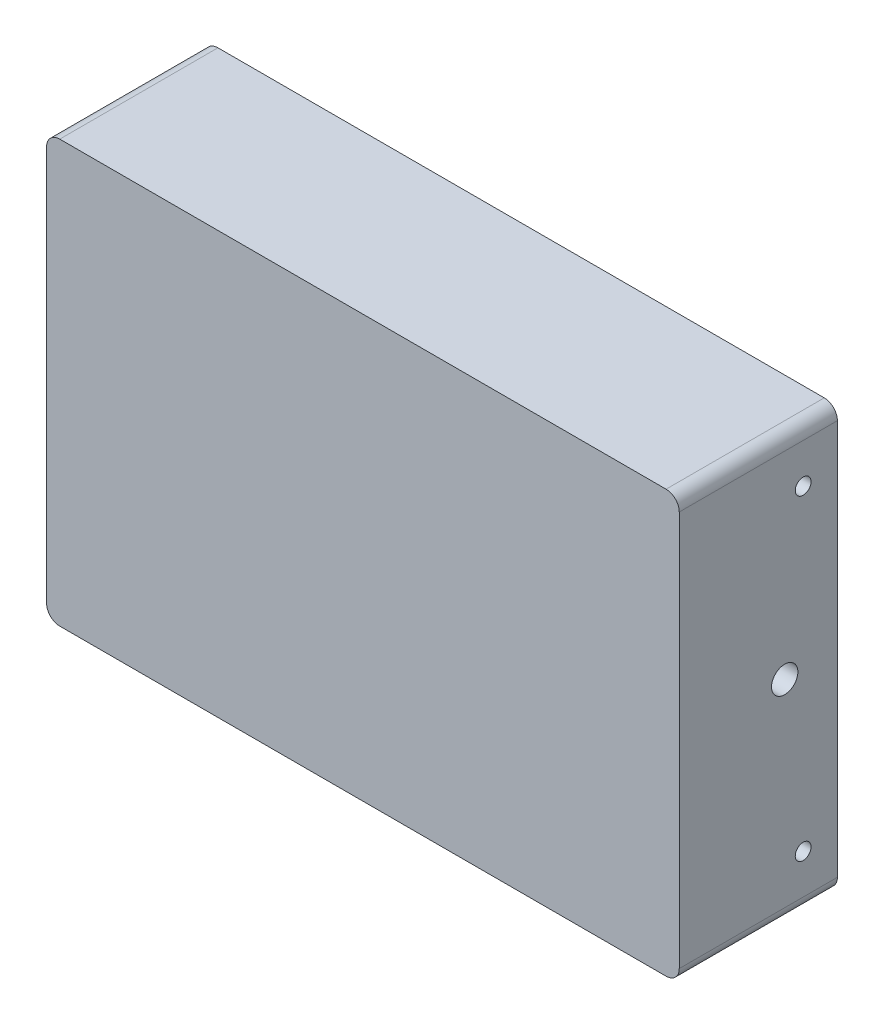
from build123d import *

# Parameters (mm, degrees)
SKETCH2_R               = 4
BOSS_EXTRUDE1_DEPTH     = 20
SKETCH3_W               = 110
SKETCH3_H               = 80
BOSS_EXTRUDE2_DEPTH     = 10
SKETCH4_W               = 2.5
SKETCH4_H               = 5.6
CUT_EXTRUDE1_DEPTH      = 10
SKETCH5_W               = 30
SKETCH5_H               = 80
BOSS_EXTRUDE4_DEPTH     = 10
SKETCH8_R               = 1.5
CUT_EXTRUDE2_DEPTH      = 120
CUT_EXTRUDE3_DEPTH      = 40
CUT_EXTRUDE3_DEPTH_BACK = 20
SKETCH9_R               = 2.5
SKETCH10_W              = 3.7
SKETCH10_H              = 8
CUT_EXTRUDE4_DEPTH      = 15
FILLET1_R               = 2.5


with BuildPart() as part:
    # Sketch2 → Boss-Extrude1 (new body)
    with BuildSketch(Plane.XY):
        Polygon((42.5, -22.5), (42.5, 22.5), (55, 22.5), (55, 40), (-55, 40), (-55, -40), (55, -40), (55, -22.5), align=None)
        with Locations((-37.5, 30)):
            Circle(SKETCH2_R, mode=Mode.SUBTRACT)
        with Locations((37.5, 30)):
            Circle(SKETCH2_R, mode=Mode.SUBTRACT)
        with Locations((-37.5, -30)):
            Circle(SKETCH2_R, mode=Mode.SUBTRACT)
        with Locations((37.5, -30)):
            Circle(SKETCH2_R, mode=Mode.SUBTRACT)
    extrude(amount=BOSS_EXTRUDE1_DEPTH)

    # Sketch3 → Boss-Extrude2 (add)
    with BuildSketch(Plane.XY.offset(20)):
        Rectangle(SKETCH3_W, SKETCH3_H)
    extrude(amount=BOSS_EXTRUDE2_DEPTH)

    # Sketch4 → Cut-Extrude1 (cut)
    with BuildSketch(Plane.XY):
        with Locations((-45, 30)):
            Rectangle(SKETCH4_W, SKETCH4_H)
        with Locations((45, 30)):
            Rectangle(SKETCH4_W, SKETCH4_H)
        with Locations((-45, -30)):
            Rectangle(SKETCH4_W, SKETCH4_H)
        with Locations((45, -30)):
            Rectangle(SKETCH4_W, SKETCH4_H)
    extrude(amount=CUT_EXTRUDE1_DEPTH, mode=Mode.SUBTRACT)

    # Sketch5 → Boss-Extrude4 (add)
    with BuildSketch(Plane(origin=(55, 0, 0), x_dir=(0, 0, -1), z_dir=(1, 0, 0))):
        with Locations((-15, 0)):
            Rectangle(SKETCH5_W, SKETCH5_H)
    extrude(amount=BOSS_EXTRUDE4_DEPTH)

    # Sketch8 → Cut-Extrude2 (cut)
    with BuildSketch(Plane(origin=(65, 0, 0), x_dir=(0, 0, -1), z_dir=(1, 0, 0))):
        with Locations((-6.5, 30)):
            Circle(SKETCH8_R)
        with Locations((-6.5, -30)):
            Circle(SKETCH8_R)
    extrude(amount=-CUT_EXTRUDE2_DEPTH, mode=Mode.SUBTRACT)

    # Sketch9 → Cut-Extrude3 (cut, two sides: drawn at the far end of the back side and taken through both)
    with BuildSketch(Plane(origin=(42.5, 0, 0), x_dir=(0, 0, -1), z_dir=(1, 0, 0)).offset(-CUT_EXTRUDE3_DEPTH_BACK)):
        with Locations((-10, 0)):
            Circle(SKETCH9_R)
    extrude(amount=CUT_EXTRUDE3_DEPTH + CUT_EXTRUDE3_DEPTH_BACK, mode=Mode.SUBTRACT)

    # Sketch10 → Cut-Extrude4 (cut)
    with BuildSketch(Plane(origin=(0, 0, 0), x_dir=(-1, 0, 0), z_dir=(0, 0, -1))):
        with Locations((-35.65, 0)):
            Rectangle(SKETCH10_W, SKETCH10_H)
        with Locations((-59.35, 0)):
            Rectangle(SKETCH10_W, SKETCH10_H)
    extrude(amount=-CUT_EXTRUDE4_DEPTH, mode=Mode.SUBTRACT)

    # Fillet1
    fillet1_edges = [part.edges().sort_by_distance(p)[0] for p in [
        (65, 40, 15),
        (65, -40, 15),
        (-55, -40, 15),
        (-55, 40, 15),
    ]]
    fillet(fillet1_edges, radius=FILLET1_R)


solid = part.part
